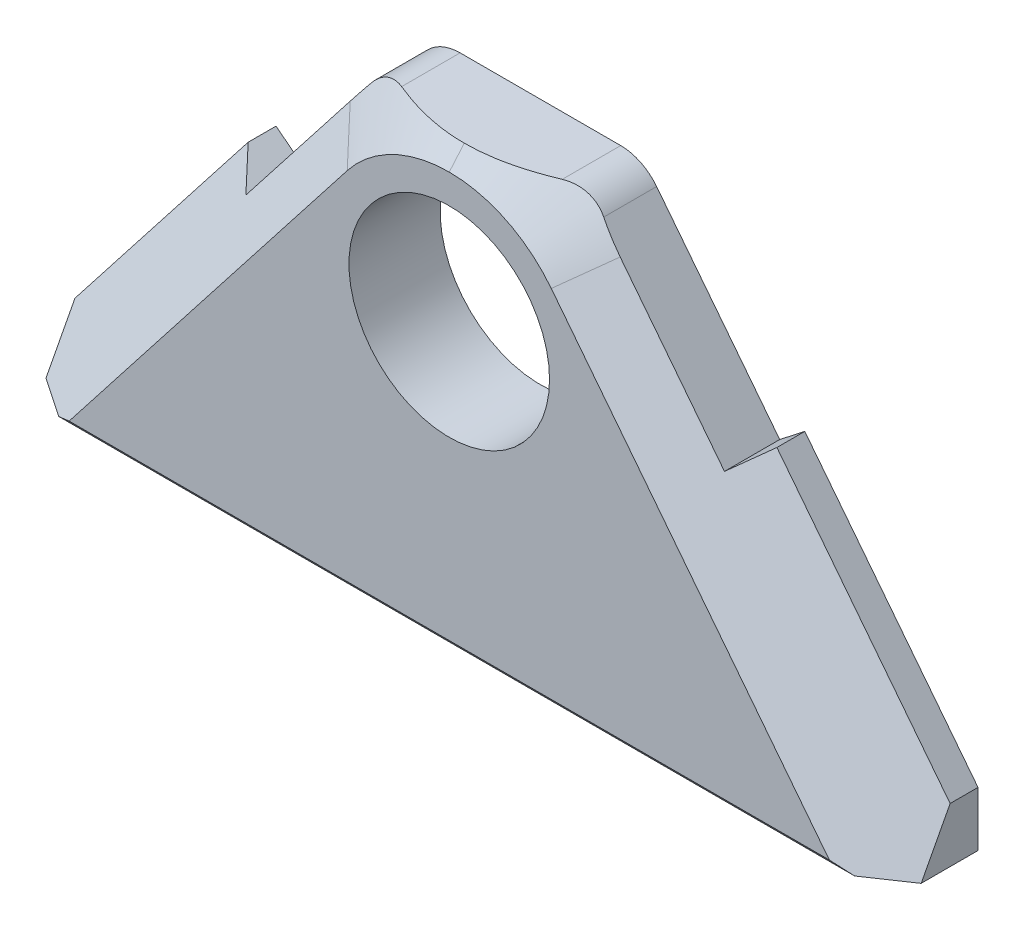
from build123d import *

# Parameters (mm, degrees)
SKETCH1_R           = 22
BOSS_EXTRUDE1_DEPTH = 20


with BuildPart() as part:
    # Sketch1 → Boss-Extrude1 (new body)
    with BuildSketch(Plane.XY):
        with BuildLine():
            Line((-17.616288532, 0), (17.616288532, 0))
            ThreePointArc((17.616288532, 0), (22, -1.012059537), (25.496396068, -3.843385247))
            Line((25.496396068, -3.843385247), (52.5, -38.406422138))
            Line((52.5, -38.406422138), (58, -34.109351193))
            Line((58, -34.109351193), (96, -82.747133216))
            Line((96, -82.747133216), (96, -94.747133216))
            Line((96, -94.747133216), (-96, -94.747133216))
            Line((-96, -94.747133216), (-96, -82.747133216))
            Line((-96, -82.747133216), (-58, -34.109351193))
            Line((-58, -34.109351193), (-52.5, -38.406422138))
            Line((-52.5, -38.406422138), (-25.496396068, -3.843385247))
            ThreePointArc((-25.496396068, -3.843385247), (-22, -1.012059537), (-17.616288532, 0))
        make_face()
        with Locations((0, -32.247133216)):
            Circle(SKETCH1_R, mode=Mode.SUBTRACT)
    extrude(amount=BOSS_EXTRUDE1_DEPTH)

    # Cut-Sweep3: sweep along a path in Sketch2
    with BuildLine(Plane.XY.offset(20)) as cut_sweep3_path:
        Line((23.882346885, -13.588198867), (87.290655754, -94.747133216))
        Line((87.290655754, -94.747133216), (-87.290655754, -94.747133216))
        Line((-87.290655754, -94.747133216), (-23.882346885, -13.588198867))
        ThreePointArc((-23.882346885, -13.588198867), (0, -1.94), (23.882346885, -13.588198867))
    # Sketch3 → Cut-Sweep3 (sweep, cut)
    with BuildSketch(Plane(origin=(0, 0, 0), x_dir=(0, 0, -1), z_dir=(1, 0, 0))):
        Polygon((-20, -3.843385247), (-20, 31.059468925), (10, 31.059468925), align=None)
    sweep(path=cut_sweep3_path.line, transition=Transition.RIGHT, mode=Mode.SUBTRACT)


solid = part.part
